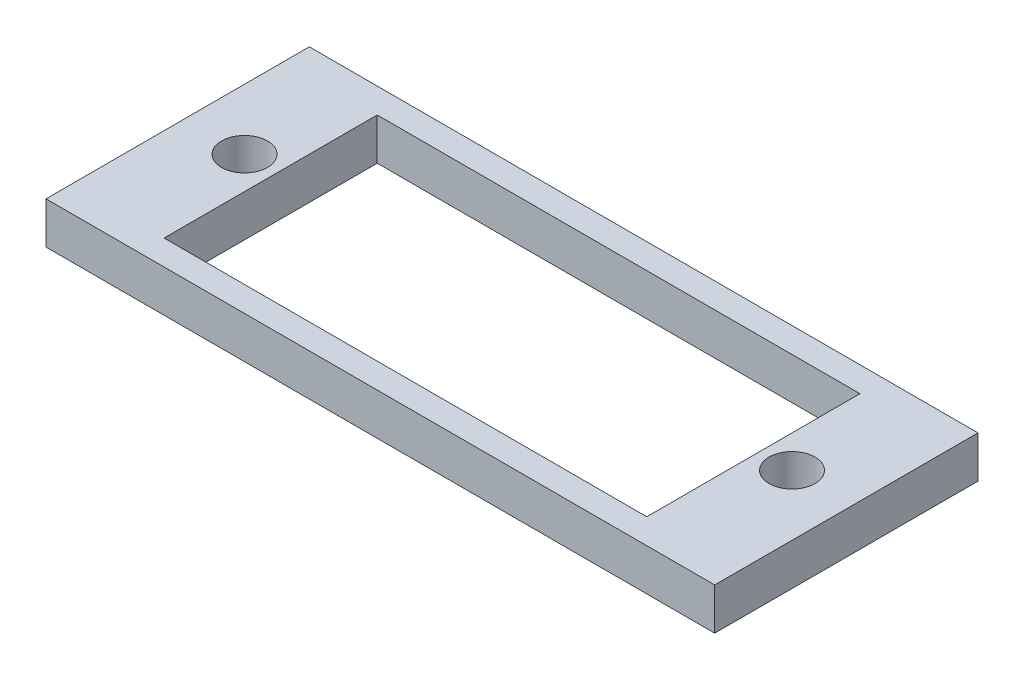
from build123d import *

# Parameters (mm, degrees)
SCHIZZO1_W                   = 32
SCHIZZO1_H                   = 12.6
SCHIZZO1_R                   = 1.1
SCHIZZO1_W_2                 = 23.1
SCHIZZO1_H_2                 = 10.2
ESTRUSIONE_ESTRUSIONE1_DEPTH = 2


with BuildPart() as part:
    # Schizzo1 → Estrusione-Estrusione1 (new body)
    with BuildSketch(Plane(origin=(0, 0, 0), x_dir=(1, 0, 0), z_dir=(0, 1, 0))):
        with Locations((16, 6.3)):
            Rectangle(SCHIZZO1_W, SCHIZZO1_H)
        with Locations(Location((2.9, 6.6, 0), (0, 0, 270))):
            Circle(SCHIZZO1_R, mode=Mode.SUBTRACT)
        with Locations(Location((29.1, 6.6, 0), (0, 0, 270))):
            Circle(SCHIZZO1_R, mode=Mode.SUBTRACT)
        with Locations((16, 6.3)):
            Rectangle(SCHIZZO1_W_2, SCHIZZO1_H_2, mode=Mode.SUBTRACT)
    extrude(amount=ESTRUSIONE_ESTRUSIONE1_DEPTH)


solid = part.part
